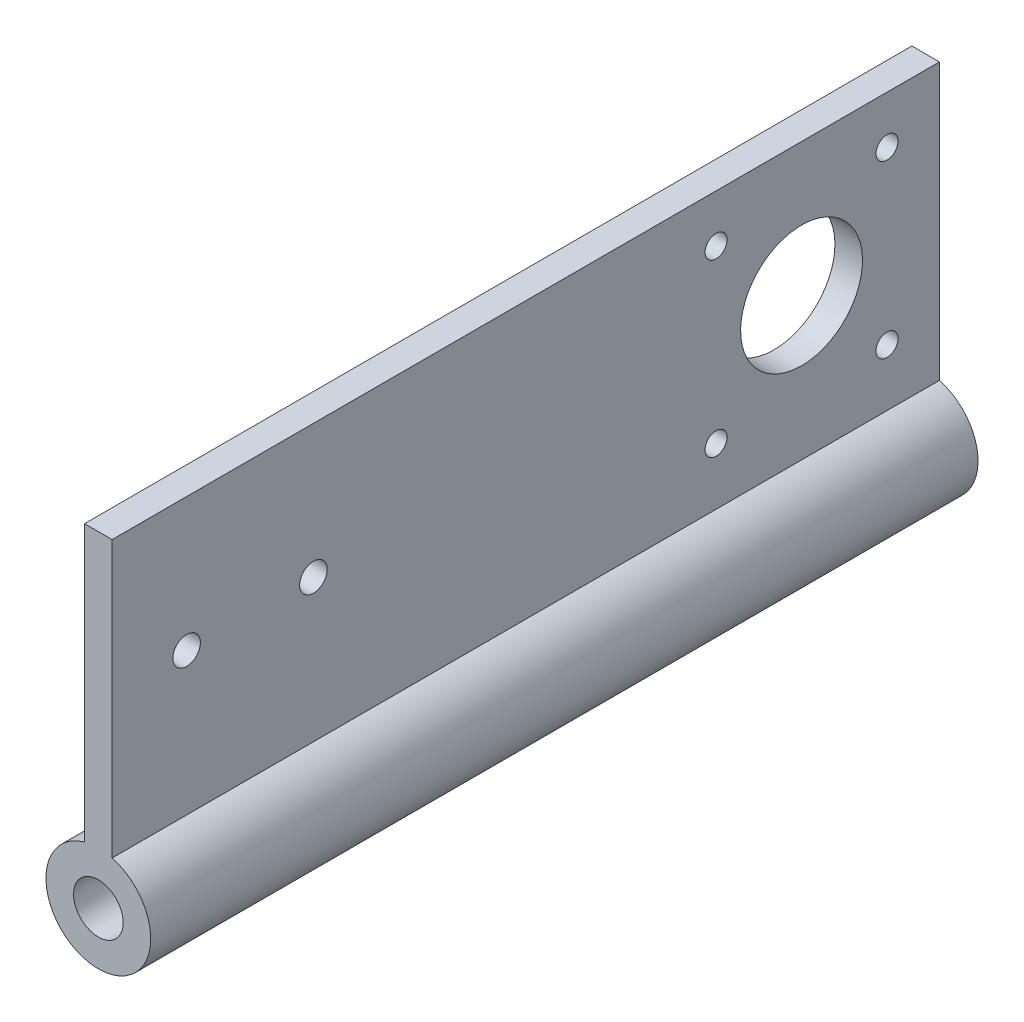
from build123d import *

# Parameters (mm, degrees)
SKETCH1_R           = 4.5
BOSS_EXTRUDE1_DEPTH = 150
SKETCH2_R           = 2
SKETCH2_R_2         = 11.05
CUT_EXTRUDE1_DEPTH  = 162.692656416
SKETCH3_R           = 2.5
CUT_EXTRUDE2_DEPTH  = 162.692656416


with BuildPart() as part:
    # Sketch1 → Boss-Extrude1 (new body)
    with BuildSketch(Plane.XY):
        with BuildLine():
            Line((-2.5, 59.16515139), (-2.5, 9.16515139))
            ThreePointArc((-2.5, 9.16515139), (0, -9.5), (2.5, 9.16515139))
            Line((2.5, 9.16515139), (2.5, 59.16515139))
            Line((2.5, 59.16515139), (-2.5, 59.16515139))
        make_face()
        Circle(SKETCH1_R, mode=Mode.SUBTRACT)
    extrude(amount=BOSS_EXTRUDE1_DEPTH)

    # Sketch2 → Cut-Extrude1 (cut, through all)
    with BuildSketch(Plane.ZY.offset(2.5)):
        with Locations(Location((9.5, 50.5, 0), (0, 0, 270))):
            Circle(SKETCH2_R)
        with Locations(Location((40.5, 50.5, 0), (0, 0, 270))):
            Circle(SKETCH2_R)
        with Locations(Location((40.5, 19.5, 0), (0, 0, 270))):
            Circle(SKETCH2_R)
        with Locations(Location((9.5, 19.5, 0), (0, 0, 270))):
            Circle(SKETCH2_R)
        with Locations(Location((25, 35, 0), (0, 0, 270))):
            Circle(SKETCH2_R_2)
    extrude(amount=-CUT_EXTRUDE1_DEPTH, mode=Mode.SUBTRACT)

    # Sketch3 → Cut-Extrude2 (cut, through all)
    with BuildSketch(Plane.ZY.offset(2.5)):
        with Locations(Location((113.5, 35, 0), (0, 0, 270))):
            Circle(SKETCH3_R)
        with Locations(Location((136.5, 35, 0), (0, 0, 270))):
            Circle(SKETCH3_R)
    extrude(amount=-CUT_EXTRUDE2_DEPTH, mode=Mode.SUBTRACT)


solid = part.part
